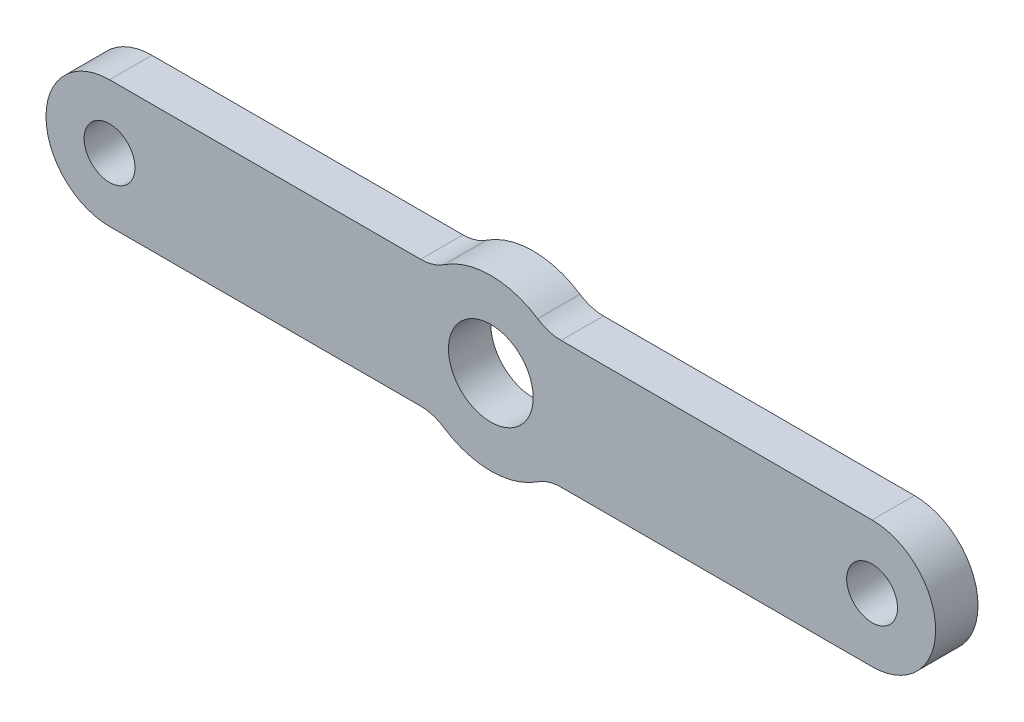
from build123d import *

# Parameters (mm, degrees)
SKETCH1_R           = 3.81
SKETCH1_R_2         = 6.35
BOSS_EXTRUDE1_DEPTH = 6.35


with BuildPart() as part:
    # Sketch1 → Boss-Extrude1 (new body)
    with BuildSketch(Plane.XY):
        with BuildLine():
            Line((-57.15, 9.525), (-10.530283709, 9.525))
            ThreePointArc((-10.530283709, 9.525), (-8.697196605, 9.795337866), (-7.02018914, 10.583333333))
            ThreePointArc((-7.02018914, 10.583333333), (0, 12.7), (7.02018914, 10.583333333))
            ThreePointArc((7.02018914, 10.583333333), (8.697196605, 9.795337866), (10.530283709, 9.525))
            Line((10.530283709, 9.525), (57.15, 9.525))
            ThreePointArc((57.15, 9.525), (66.675, 0), (57.15, -9.525))
            Line((57.15, -9.525), (10.530283709, -9.525))
            ThreePointArc((10.530283709, -9.525), (8.697196605, -9.795337866), (7.02018914, -10.583333333))
            ThreePointArc((7.02018914, -10.583333333), (0, -12.7), (-7.02018914, -10.583333333))
            ThreePointArc((-7.02018914, -10.583333333), (-8.697196605, -9.795337866), (-10.530283709, -9.525))
            Line((-10.530283709, -9.525), (-57.15, -9.525))
            ThreePointArc((-57.15, -9.525), (-66.675, 0), (-57.15, 9.525))
        make_face()
        with Locations((-57.15, 0)):
            Circle(SKETCH1_R, mode=Mode.SUBTRACT)
        with Locations((57.15, 0)):
            Circle(SKETCH1_R, mode=Mode.SUBTRACT)
        Circle(SKETCH1_R_2, mode=Mode.SUBTRACT)
    extrude(amount=BOSS_EXTRUDE1_DEPTH)


solid = part.part
